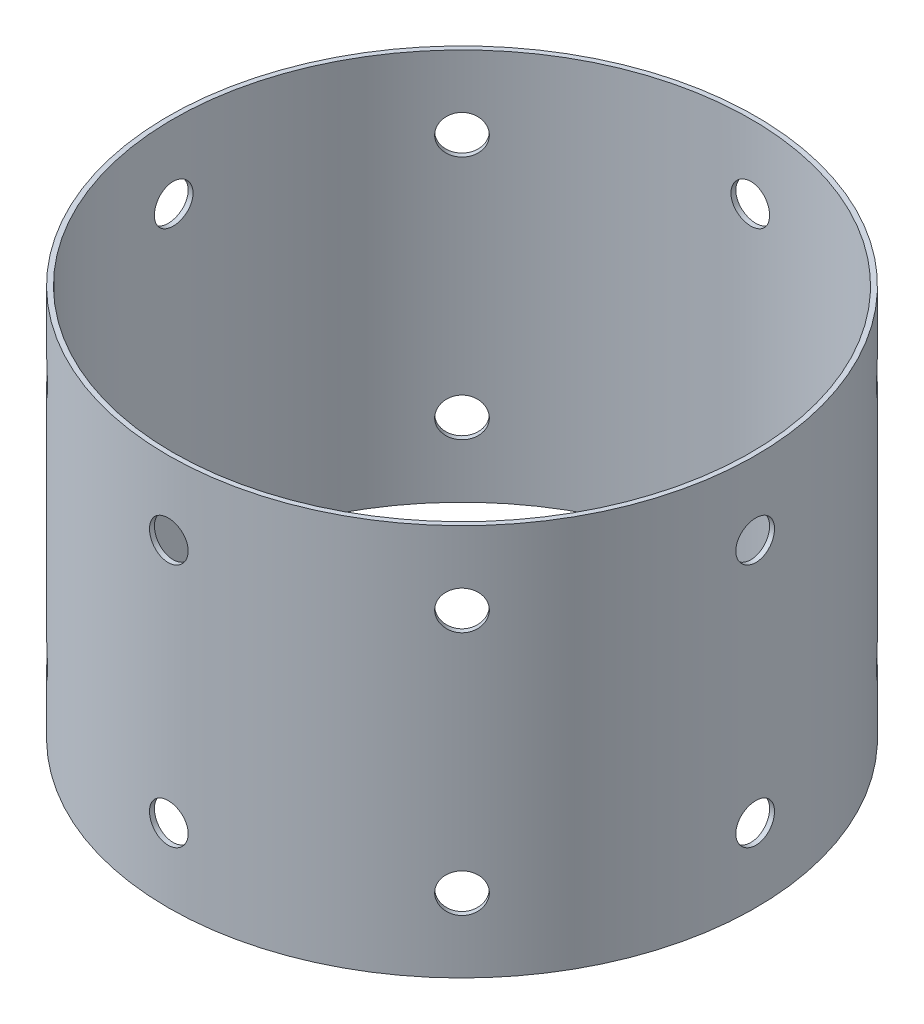
from build123d import *

# Parameters (mm, degrees)
SKETCH2_R                              = 76.2
SKETCH2_R_2                            = 74.93
BOSS_EXTRUDE1_DEPTH                    = 101.6
LOX_TO_KERO_LOX_SIDE_HOLES_REACH       = 168.559
LOX_TO_KERO_LOX_SIDE_HOLES_END_RADIUS  = 76.2
SKETCH3_R                              = 5.0165
CIRPATTERN1_COUNT                      = 8
LOX_TO_KERO_KERO_SIDE_HOLES_REACH      = 168.559
LOX_TO_KERO_KERO_SIDE_HOLES_END_RADIUS = 76.2
SKETCH4_R                              = 5.0165
CIRPATTERN2_COUNT                      = 8


with BuildPart() as part:
    # Sketch2 → Boss-Extrude1 (new body)
    with BuildSketch(Plane(origin=(0, 0, 0), x_dir=(1, 0, 0), z_dir=(0, 1, 0))):
        with Locations(Location((0, 0, 0), (0, 0, 270))):
            Circle(SKETCH2_R)
        with Locations(Location((0, 0, 0), (0, 0, 270))):
            Circle(SKETCH2_R_2, mode=Mode.SUBTRACT)
    extrude(amount=BOSS_EXTRUDE1_DEPTH)

    # LOX to Kero, LOX Side Holes: up to this cylinder (the profile starts inside it)
    lox_to_kero_lox_side_holes_end = Plane(origin=(0, 82.55, 0), z_dir=(0, -1, 0)) * Cylinder(LOX_TO_KERO_LOX_SIDE_HOLES_END_RADIUS, 490.518, mode=Mode.PRIVATE)
    # Sketch3 → LOX to Kero, LOX Side Holes (cut, up to the surface)
    with BuildSketch(Plane(origin=(0, 127, 0), x_dir=(0, 0, -1), z_dir=(1, 0, 0)), mode=Mode.PRIVATE) as lox_to_kero_lox_side_holes_sk1:
        with Locations(Location((0, -44.45, 0), (0, 0, 180))):
            Circle(SKETCH3_R)
    lox_to_kero_lox_side_holes_tool1 = extrude(lox_to_kero_lox_side_holes_sk1.sketch, amount=LOX_TO_KERO_LOX_SIDE_HOLES_REACH, mode=Mode.PRIVATE) & lox_to_kero_lox_side_holes_end
    lox_to_kero_lox_side_holes = lox_to_kero_lox_side_holes_tool1.solids().sort_by_distance((0, 82.55, 0))[0]
    add(lox_to_kero_lox_side_holes, mode=Mode.SUBTRACT)

    # CirPattern1: LOX to Kero, LOX Side Holes ×8 about axis
    cirpattern1_axis = Axis((0, 101.6, 0), (0, 1, 0))
    for i in range(1, CIRPATTERN1_COUNT):
        add(lox_to_kero_lox_side_holes.rotate(cirpattern1_axis, i * 360 / CIRPATTERN1_COUNT), mode=Mode.SUBTRACT)

    # LOX to Kero, Kero Side Holes: up to this cylinder (the profile starts inside it)
    lox_to_kero_kero_side_holes_end = Plane(origin=(0, 19.05, 0), z_dir=(0, -1, 0)) * Cylinder(LOX_TO_KERO_KERO_SIDE_HOLES_END_RADIUS, 490.518, mode=Mode.PRIVATE)
    # Sketch4 → LOX to Kero, Kero Side Holes (cut, up to the surface)
    with BuildSketch(Plane(origin=(0, -25.4, 0), x_dir=(0, 0, 1), z_dir=(1, 0, 0)), mode=Mode.PRIVATE) as lox_to_kero_kero_side_holes_sk1:
        with Locations((0, -44.45)):
            Circle(SKETCH4_R)
    lox_to_kero_kero_side_holes_tool1 = extrude(lox_to_kero_kero_side_holes_sk1.sketch, amount=LOX_TO_KERO_KERO_SIDE_HOLES_REACH, mode=Mode.PRIVATE) & lox_to_kero_kero_side_holes_end
    lox_to_kero_kero_side_holes = lox_to_kero_kero_side_holes_tool1.solids().sort_by_distance((0, 19.05, 0))[0]
    add(lox_to_kero_kero_side_holes, mode=Mode.SUBTRACT)

    # CirPattern2: LOX to Kero, Kero Side Holes ×8 about axis
    cirpattern2_axis = Axis((0, 0, 0), (0, 1, 0))
    for i in range(1, CIRPATTERN2_COUNT):
        add(lox_to_kero_kero_side_holes.rotate(cirpattern2_axis, i * 360 / CIRPATTERN2_COUNT), mode=Mode.SUBTRACT)


solid = part.part
